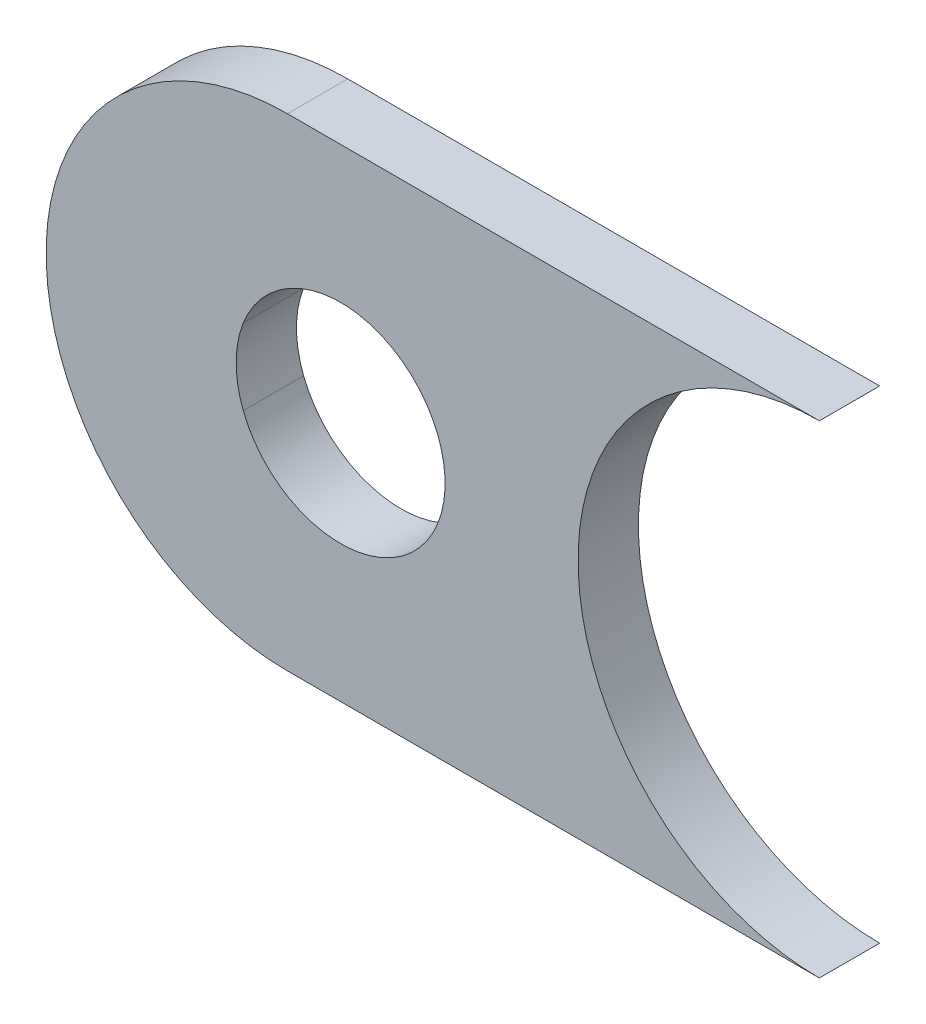
from build123d import *

# Parameters (mm, degrees)
SKETCH2_R           = 5.5
BOSS_EXTRUDE1_DEPTH = 3.175


with BuildPart() as part:
    # Sketch2 → Boss-Extrude1 (new body)
    with BuildSketch(Plane.XY):
        with BuildLine():
            ThreePointArc((0, -12.7), (-12.7, 0), (0, 12.7))
            Line((0, 12.7), (-28, 12.7))
            ThreePointArc((-28, 12.7), (-40.7, 0), (-28, -12.7))
            Line((-28, -12.7), (0, -12.7))
        make_face()
        with Locations((-25.2, 0)):
            Circle(SKETCH2_R, mode=Mode.SUBTRACT)
    extrude(amount=BOSS_EXTRUDE1_DEPTH)


solid = part.part
